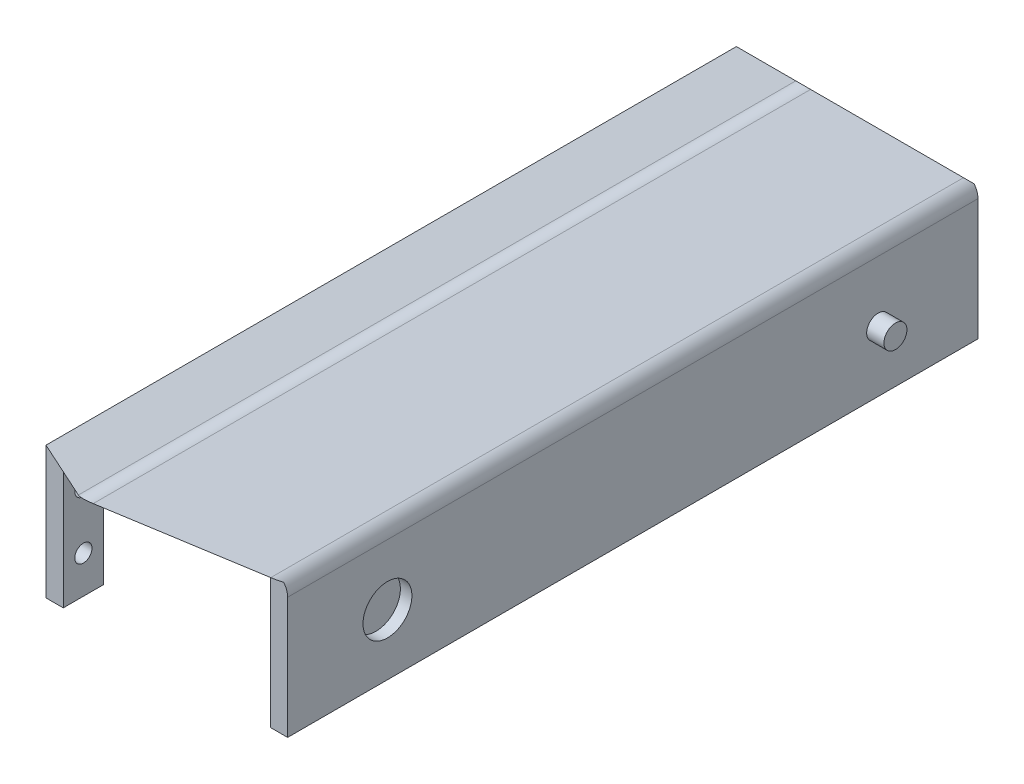
from build123d import *

# Parameters (mm, degrees)
BOSS_EXTRUDE1_DEPTH = 120
BOSS_EXTRUDE2_DEPTH = 15
CUT_EXTRUDE1_DEPTH  = 43
CUT_EXTRUDE2_DEPTH  = 43
FILLET1_R           = 3
FILLET2_R           = 3
SKETCH6_W           = 39.5
SKETCH6_H           = 23
SKETCH6_R           = 1.5
CUT_EXTRUDE3_DEPTH  = 3
SKETCH7_R           = 4.25
CUT_EXTRUDE4_DEPTH  = 2
SKETCH8_R           = 4.25
CUT_EXTRUDE5_DEPTH  = 2
BOSS_EXTRUDE3_START = 2
SKETCH9_R           = 4.25
BOSS_EXTRUDE3_DEPTH = 2
SKETCH10_R          = 2
BOSS_EXTRUDE4_DEPTH = 3


with BuildPart() as part:
    # Sketch2 → Boss-Extrude1 (new body)
    with BuildSketch(Plane.XY):
        Polygon((-18, 23), (0, 31.556461876), (18, 23), (18, 20), (18, 0), (21, 0), (21, 23), (0, 33), (-21, 23), (-21, 0), (-18, 0), (-18, 20), align=None)
    extrude(amount=BOSS_EXTRUDE1_DEPTH)

    # Sketch3 → Boss-Extrude2 (add)
    with BuildSketch(Plane.XY.offset(120)):
        Polygon((-18, 23), (-21, 23), (0, 33), (21, 23), (18, 23), (0, 31.556461876), align=None)
    extrude(amount=BOSS_EXTRUDE2_DEPTH)

    # Sketch4 → Cut-Extrude1 (cut)
    with BuildSketch(Plane.ZY.offset(21)):
        Polygon((135, 23), (120, 23), (135, 33), align=None)
    extrude(amount=-CUT_EXTRUDE1_DEPTH, mode=Mode.SUBTRACT)

    # Sketch5 → Cut-Extrude2 (cut)
    with BuildSketch(Plane(origin=(21, 0, 0), x_dir=(0, 0, -1), z_dir=(1, 0, 0))):
        Polygon((0, 23), (0, 33), (-10, 33), align=None)
    extrude(amount=-CUT_EXTRUDE2_DEPTH, mode=Mode.SUBTRACT)

    # Fillet1
    fillet1_edges = [part.edges().sort_by_distance(p)[0] for p in [
        (0, 33, 72.5),
    ]]
    fillet(fillet1_edges, radius=FILLET1_R)

    # Fillet2
    fillet2_edges = [part.edges().sort_by_distance(p)[0] for p in [
        (21, 23, 60),
    ]]
    fillet(fillet2_edges, radius=FILLET2_R)

    # Sketch6 → Cut-Extrude3 (cut)
    with BuildSketch(Plane.ZY.offset(21)):
        with Locations((26.75, 11.5)):
            Rectangle(SKETCH6_W, SKETCH6_H)
        with Locations((93.25, 11.5)):
            Rectangle(SKETCH6_W, SKETCH6_H)
        with Locations((116.5, 6.5)):
            Circle(SKETCH6_R)
        with Locations((116.5, 16.5)):
            Circle(SKETCH6_R)
        with Locations((70, 6.5)):
            Circle(SKETCH6_R)
        with Locations((50, 16.5)):
            Circle(SKETCH6_R)
        with Locations((3.5, 16.5)):
            Circle(SKETCH6_R)
        with Locations((3.5, 6.5)):
            Circle(SKETCH6_R)
        with Locations(Location((50, 6.5, 0), (0, 0, 180))):
            Circle(SKETCH6_R)
        with Locations((70, 16.5)):
            Circle(SKETCH6_R)
    extrude(amount=-CUT_EXTRUDE3_DEPTH, mode=Mode.SUBTRACT)

    # Sketch7 → Cut-Extrude4 (cut)
    with BuildSketch(Plane(origin=(21, 0, 0), x_dir=(0, 0, -1), z_dir=(1, 0, 0))):
        with Locations((-102.649161404, 10.552899521)):
            Circle(SKETCH7_R)
    extrude(amount=-CUT_EXTRUDE4_DEPTH, mode=Mode.SUBTRACT)

    # Sketch8 → Cut-Extrude5 (cut)
    with BuildSketch(Plane(origin=(21, 0, 0), x_dir=(0, 0, -1), z_dir=(1, 0, 0))):
        with Locations((-17.350838596, 10.552899521)):
            Circle(SKETCH8_R)
    extrude(amount=-CUT_EXTRUDE5_DEPTH, mode=Mode.SUBTRACT)

    # Sketch9 → Boss-Extrude3 (add)
    with BuildSketch(Plane(origin=(19, 0, 0), x_dir=(0, 0, -1), z_dir=(1, 0, 0)).offset(BOSS_EXTRUDE3_START)):
        with Locations((-17.350838596, 10.552899521)):
            Circle(SKETCH9_R)
    extrude(amount=-BOSS_EXTRUDE3_DEPTH)

    # Sketch10 → Boss-Extrude4 (add)
    with BuildSketch(Plane(origin=(21, 0, 0), x_dir=(0, 0, -1), z_dir=(1, 0, 0))):
        with Locations((-17.350838596, 10.552899521)):
            Circle(SKETCH10_R)
    extrude(amount=BOSS_EXTRUDE4_DEPTH)


solid = part.part
